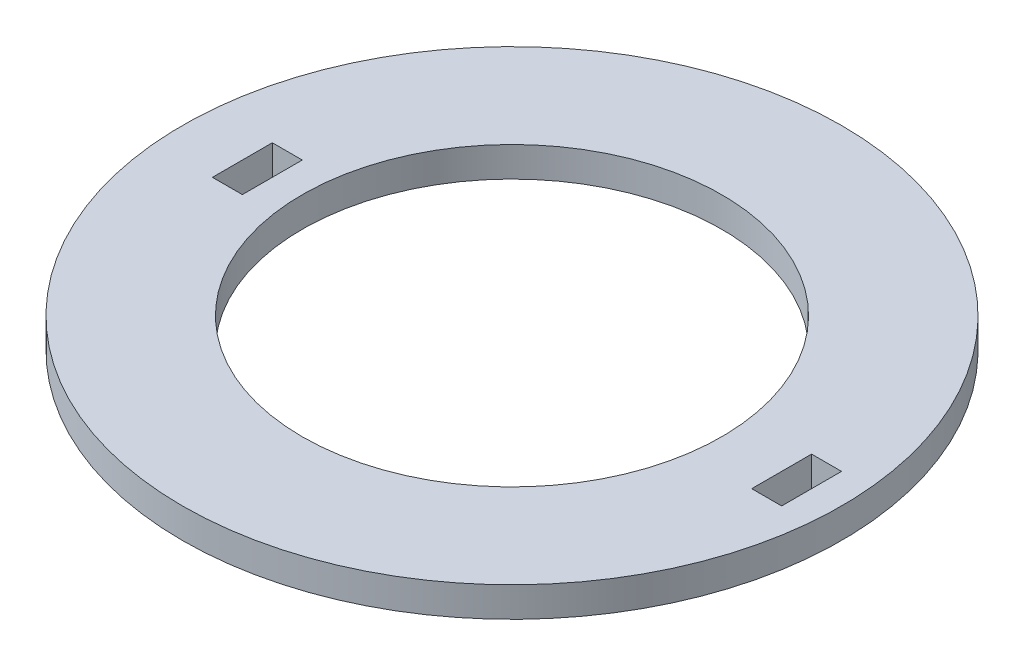
from build123d import *

# Parameters (mm, degrees)
SKETCH1_R           = 55
SKETCH1_R_2         = 35
BOSS_EXTRUDE1_DEPTH = 5
SKETCH2_W           = 5
SKETCH2_H           = 10
CUT_EXTRUDE1_DEPTH  = 5


with BuildPart() as part:
    # Sketch1 → Boss-Extrude1 (new body)
    with BuildSketch(Plane(origin=(0, 0, 0), x_dir=(1, 0, 0), z_dir=(0, 1, 0))):
        with Locations(Location((0, 0, 0), (0, 0, 270))):
            Circle(SKETCH1_R)
        with Locations(Location((0, 0, 0), (0, 0, 270))):
            Circle(SKETCH1_R_2, mode=Mode.SUBTRACT)
    extrude(amount=BOSS_EXTRUDE1_DEPTH)

    # Sketch2 → Cut-Extrude1 (cut)
    with BuildSketch(Plane(origin=(0, 5, 0), x_dir=(1, 0, 0), z_dir=(0, 1, 0))):
        with Locations((-42.5, 0)):
            Rectangle(SKETCH2_W, SKETCH2_H)
        with Locations((47.5, 0)):
            Rectangle(SKETCH2_W, SKETCH2_H)
    extrude(amount=-CUT_EXTRUDE1_DEPTH, mode=Mode.SUBTRACT)


solid = part.part
